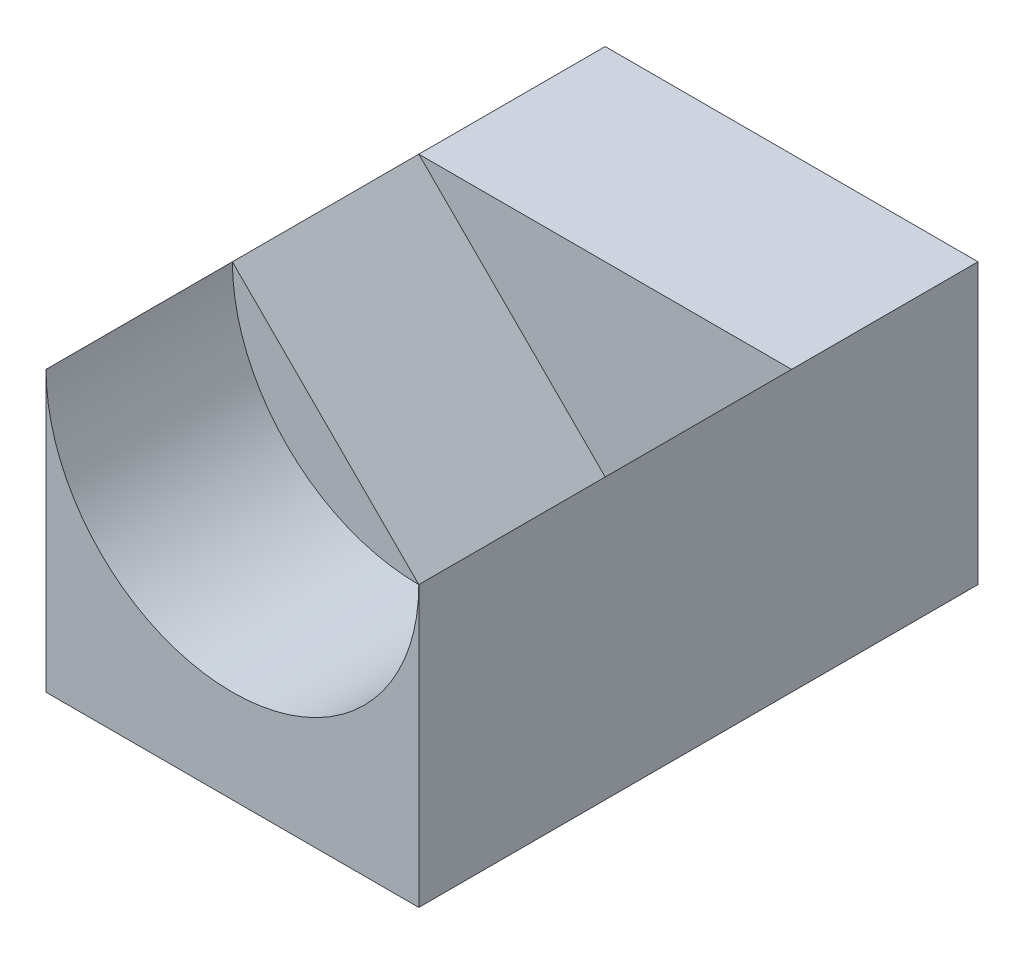
from build123d import *

# Parameters (mm, degrees)
SKETCH1_W           = 40
SKETCH1_H           = 60
BOSS_EXTRUDE1_DEPTH = 30
CUT_EXTRUDE1_DEPTH  = 20
CUT_EXTRUDE2_DEPTH  = 20


with BuildPart() as part:
    # Sketch1 → Boss-Extrude1 (new body)
    with BuildSketch(Plane(origin=(0, 0, 0), x_dir=(1, 0, 0), z_dir=(0, 1, 0))):
        Rectangle(SKETCH1_W, SKETCH1_H)
    extrude(amount=BOSS_EXTRUDE1_DEPTH)

    # Sketch2 → Cut-Extrude1 (cut)
    with BuildSketch(Plane.XY.offset(30)):
        with BuildLine():
            Line((-20, 30), (20, 30))
            ThreePointArc((20, 30), (0, 10), (-20, 30))
        make_face()
    extrude(amount=-CUT_EXTRUDE1_DEPTH, mode=Mode.SUBTRACT)

    # Sketch3 → Cut-Extrude2 (cut)
    with BuildSketch(Plane.XY.offset(10)):
        Polygon((-20, 30), (0, 10), (20, 30), align=None)
    extrude(amount=-CUT_EXTRUDE2_DEPTH, mode=Mode.SUBTRACT)


solid = part.part
